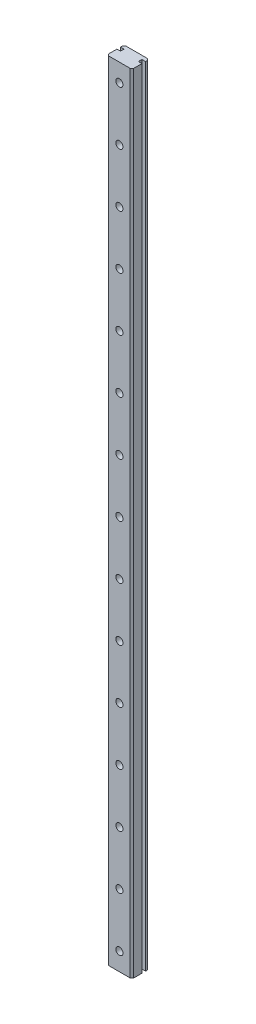
from build123d import *

# Parameters (mm, degrees)
EXTRUDE_1_DEPTH     = 220
SKETCH_2_R          = 1
CUT_EXTRUDE_1_DEPTH = 10
CHAMFER_1_SIZE      = 0.5
SKETCH_3_R          = 2.383304988
CUT_EXTRUDE_2_DEPTH = 1


with BuildPart() as part:
    # 草图1 → 凸台-拉伸1 (new body)
    with BuildSketch(Plane(origin=(0, 0, 0), x_dir=(1, 0, 0), z_dir=(0, 1, 0))):
        Polygon((-3.5, 0.4), (-3.5, -2.4), (3.5, -2.4), (3.5, 0.4), (2.5, 0.4), (2.5, 1.4), (3.5, 1.4), (3.5, 2.4), (-3.5, 2.4), (-3.5, 1.4), (-2.5, 1.4), (-2.5, 0.4), align=None)
    extrude(amount=EXTRUDE_1_DEPTH)

    # 草图2 → 切除-拉伸1 (cut)
    with BuildSketch(Plane(origin=(0, 0, -2.4), x_dir=(-1, 0, 0), z_dir=(0, 0, -1))):
        with Locations((0, 5)):
            Circle(SKETCH_2_R)
        with Locations((0, 20)):
            Circle(SKETCH_2_R)
        with Locations((0, 35)):
            Circle(SKETCH_2_R)
        with Locations((0, 50)):
            Circle(SKETCH_2_R)
        with Locations((0, 65)):
            Circle(SKETCH_2_R)
        with Locations((0, 80)):
            Circle(SKETCH_2_R)
        with Locations((0, 95)):
            Circle(SKETCH_2_R)
        with Locations((0, 110)):
            Circle(SKETCH_2_R)
        with Locations((0, 125)):
            Circle(SKETCH_2_R)
        with Locations((0, 140)):
            Circle(SKETCH_2_R)
        with Locations((0, 155)):
            Circle(SKETCH_2_R)
        with Locations((0, 170)):
            Circle(SKETCH_2_R)
        with Locations((0, 185)):
            Circle(SKETCH_2_R)
        with Locations((0, 200)):
            Circle(SKETCH_2_R)
        with Locations((0, 215)):
            Circle(SKETCH_2_R)
    extrude(amount=-CUT_EXTRUDE_1_DEPTH, mode=Mode.SUBTRACT)

    # 倒角1
    chamfer_1_edges = [part.edges().sort_by_distance(p)[0] for p in [
        (-3.5, 110, -2.4),
        (3.5, 110, -2.4),
        (3.5, 110, 2.4),
        (-3.5, 110, 2.4),
    ]]
    chamfer(chamfer_1_edges, length=CHAMFER_1_SIZE)

    # 草图3 → 切除-拉伸2 (cut)
    with BuildSketch(Plane(origin=(0, 0, -2.4), x_dir=(-1, 0, 0), z_dir=(0, 0, -1))):
        with Locations((0, 5)):
            Circle(SKETCH_3_R)
        with Locations((0, 20)):
            Circle(SKETCH_3_R)
        with Locations((0, 35)):
            Circle(SKETCH_3_R)
        with Locations((0, 50)):
            Circle(SKETCH_3_R)
        with Locations((0, 65)):
            Circle(SKETCH_3_R)
        with Locations((0, 80)):
            Circle(SKETCH_3_R)
        with Locations((0, 95)):
            Circle(SKETCH_3_R)
        with Locations((0, 110)):
            Circle(SKETCH_3_R)
        with Locations((0, 125)):
            Circle(SKETCH_3_R)
        with Locations((0, 140)):
            Circle(SKETCH_3_R)
        with Locations((0, 155)):
            Circle(SKETCH_3_R)
        with Locations((0, 170)):
            Circle(SKETCH_3_R)
        with Locations((0, 185)):
            Circle(SKETCH_3_R)
        with Locations((0, 200)):
            Circle(SKETCH_3_R)
        with Locations((0, 215)):
            Circle(SKETCH_3_R)
    extrude(amount=-CUT_EXTRUDE_2_DEPTH, mode=Mode.SUBTRACT)


solid = part.part
